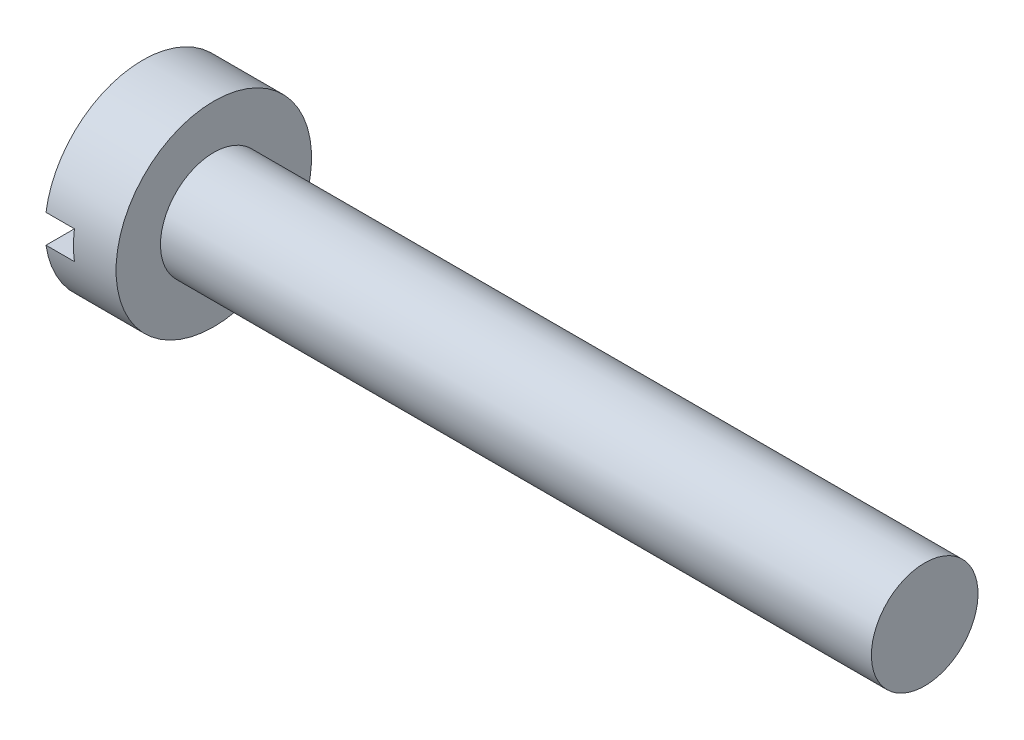
from build123d import *

# Parameters (mm, degrees)
SKETCH2_W          = 5.5
SKETCH2_H          = 0.8
CUT_EXTRUDE1_DEPTH = 0.8


with BuildPart() as part:
    # Sketch1 → Revolve1 (revolve)
    with BuildSketch(Plane.XY):
        Polygon((0, 0), (0, 2.75), (2, 2.75), (2, 1.5), (22, 1.5), (22, 0), align=None)
    revolve(axis=Axis((22, 0, 0), (-1, 0, 0)))

    # Sketch2 → Cut-Extrude1 (cut)
    with BuildSketch(Plane.ZY):
        Rectangle(SKETCH2_W, SKETCH2_H)
    extrude(amount=-CUT_EXTRUDE1_DEPTH, mode=Mode.SUBTRACT)


solid = part.part
